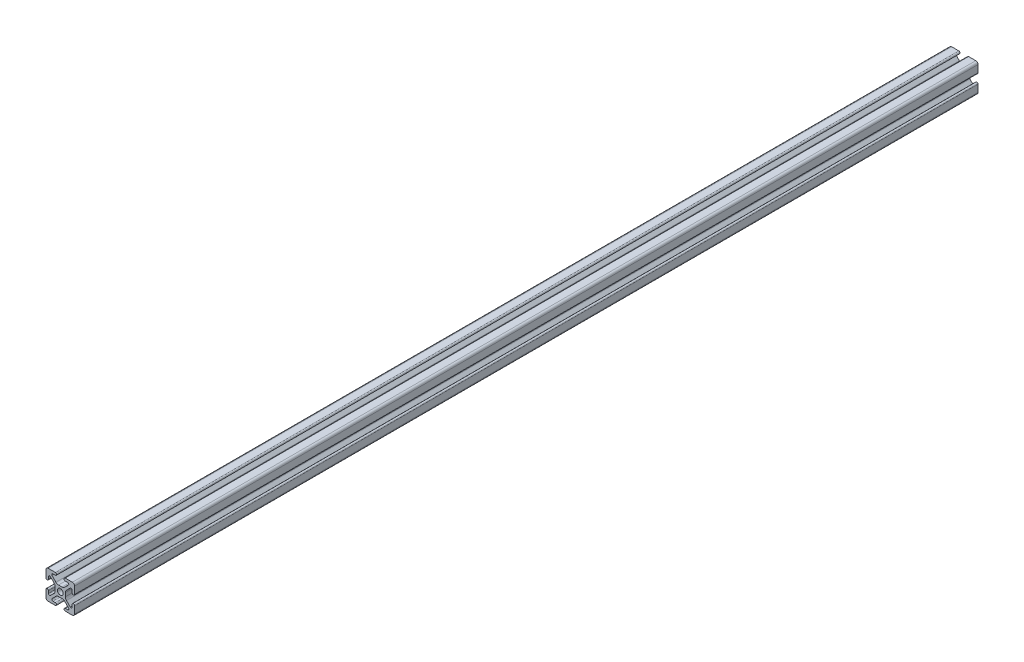
from build123d import *

# Parameters (mm, degrees)
SKETCH1_R           = 2.5
BOSS_EXTRUDE1_DEPTH = 790


with BuildPart() as part:
    # Sketch1 → Boss-Extrude1 (new body)
    with BuildSketch(Plane(origin=(0, 0, -25), x_dir=(-1, 0, 0), z_dir=(0, 0, -1))):
        with BuildLine():
            Line((12.5, 4.32), (12.5, 10.537068835))
            ThreePointArc((12.5, 10.537068835), (11.925070773, 11.925070773), (10.537068835, 12.5))
            Line((10.537068835, 12.5), (4.32, 12.5))
            ThreePointArc((4.32, 12.5), (3.25, 11.43), (4.32, 10.36))
            Line((4.32, 10.36), (6.42, 10.36))
            ThreePointArc((6.42, 10.36), (7.35325999, 9.736168088), (7.133653911, 8.635298598))
            Line((7.133653911, 8.635298598), (3.795290766, 5.301828272))
            ThreePointArc((3.795290766, 5.301828272), (2.76743922, 4.61585726), (1.555406707, 4.375))
            Line((1.555406707, 4.375), (-1.555406707, 4.375))
            ThreePointArc((-1.555406707, 4.375), (-2.76743922, 4.61585726), (-3.795290766, 5.301828272))
            Line((-3.795290766, 5.301828272), (-7.133653912, 8.635298598))
            ThreePointArc((-7.133653912, 8.635298598), (-7.35325999, 9.736168088), (-6.42, 10.36))
            Line((-6.42, 10.36), (-4.32, 10.36))
            ThreePointArc((-4.32, 10.36), (-3.25, 11.43), (-4.32, 12.5))
            Line((-4.32, 12.5), (-10.537068835, 12.5))
            ThreePointArc((-10.537068835, 12.5), (-11.925070773, 11.925070773), (-12.5, 10.537068835))
            Line((-12.5, 10.537068835), (-12.5, 4.32))
            ThreePointArc((-12.5, 4.32), (-11.43, 3.25), (-10.36, 4.32))
            Line((-10.36, 4.32), (-10.36, 6.396886949))
            ThreePointArc((-10.36, 6.396886949), (-9.736852394, 7.329863489), (-8.636346088, 7.111588351))
            Line((-8.636346088, 7.111588351), (-5.432204773, 3.912143135))
            ThreePointArc((-5.432204773, 3.912143135), (-4.708985779, 2.831057106), (-4.455, 1.555406707))
            Line((-4.455, 1.555406707), (-4.455, -1.555406707))
            ThreePointArc((-4.455, -1.555406707), (-4.708985779, -2.831057106), (-5.432204773, -3.912143135))
            Line((-5.432204773, -3.912143135), (-8.636346088, -7.111588351))
            ThreePointArc((-8.636346088, -7.111588351), (-9.736852394, -7.329863489), (-10.36, -6.396886949))
            Line((-10.36, -6.396886949), (-10.36, -4.32))
            ThreePointArc((-10.36, -4.32), (-11.43, -3.25), (-12.5, -4.32))
            Line((-12.5, -4.32), (-12.5, -10.537068835))
            ThreePointArc((-12.5, -10.537068835), (-11.925070773, -11.925070773), (-10.537068835, -12.5))
            Line((-10.537068835, -12.5), (-4.387856959, -12.5))
            ThreePointArc((-4.387856959, -12.5), (-3.317856959, -11.43), (-4.387856959, -10.36))
            Line((-4.387856959, -10.36), (-6.42, -10.36))
            ThreePointArc((-6.42, -10.36), (-7.35325999, -9.736168088), (-7.133653912, -8.635298598))
            Line((-7.133653912, -8.635298598), (-3.795290766, -5.301828272))
            ThreePointArc((-3.795290766, -5.301828272), (-2.76743922, -4.61585726), (-1.555406707, -4.375))
            Line((-1.555406707, -4.375), (1.555406707, -4.375))
            ThreePointArc((1.555406707, -4.375), (2.76743922, -4.61585726), (3.795290766, -5.301828272))
            Line((3.795290766, -5.301828272), (7.133653912, -8.635298598))
            ThreePointArc((7.133653912, -8.635298598), (7.35325999, -9.736168088), (6.42, -10.36))
            Line((6.42, -10.36), (4.387856959, -10.36))
            ThreePointArc((4.387856959, -10.36), (3.317856959, -11.43), (4.387856959, -12.5))
            Line((4.387856959, -12.5), (10.537068835, -12.5))
            ThreePointArc((10.537068835, -12.5), (11.925070773, -11.925070773), (12.5, -10.537068835))
            Line((12.5, -10.537068835), (12.5, -4.32))
            ThreePointArc((12.5, -4.32), (11.43, -3.25), (10.36, -4.32))
            Line((10.36, -4.32), (10.36, -6.396886949))
            ThreePointArc((10.36, -6.396886949), (9.736852394, -7.329863489), (8.636346088, -7.111588351))
            Line((8.636346088, -7.111588351), (5.432204773, -3.912143135))
            ThreePointArc((5.432204773, -3.912143135), (4.708985779, -2.831057106), (4.455, -1.555406707))
            Line((4.455, -1.555406707), (4.455, 1.555406707))
            ThreePointArc((4.455, 1.555406707), (4.708985779, 2.831057106), (5.432204773, 3.912143135))
            Line((5.432204773, 3.912143135), (8.636346088, 7.111588351))
            ThreePointArc((8.636346088, 7.111588351), (9.736852394, 7.329863489), (10.36, 6.396886949))
            Line((10.36, 6.396886949), (10.36, 4.32))
            ThreePointArc((10.36, 4.32), (11.43, 3.25), (12.5, 4.32))
        make_face()
        Circle(SKETCH1_R, mode=Mode.SUBTRACT)
    extrude(amount=-BOSS_EXTRUDE1_DEPTH)


solid = part.part
